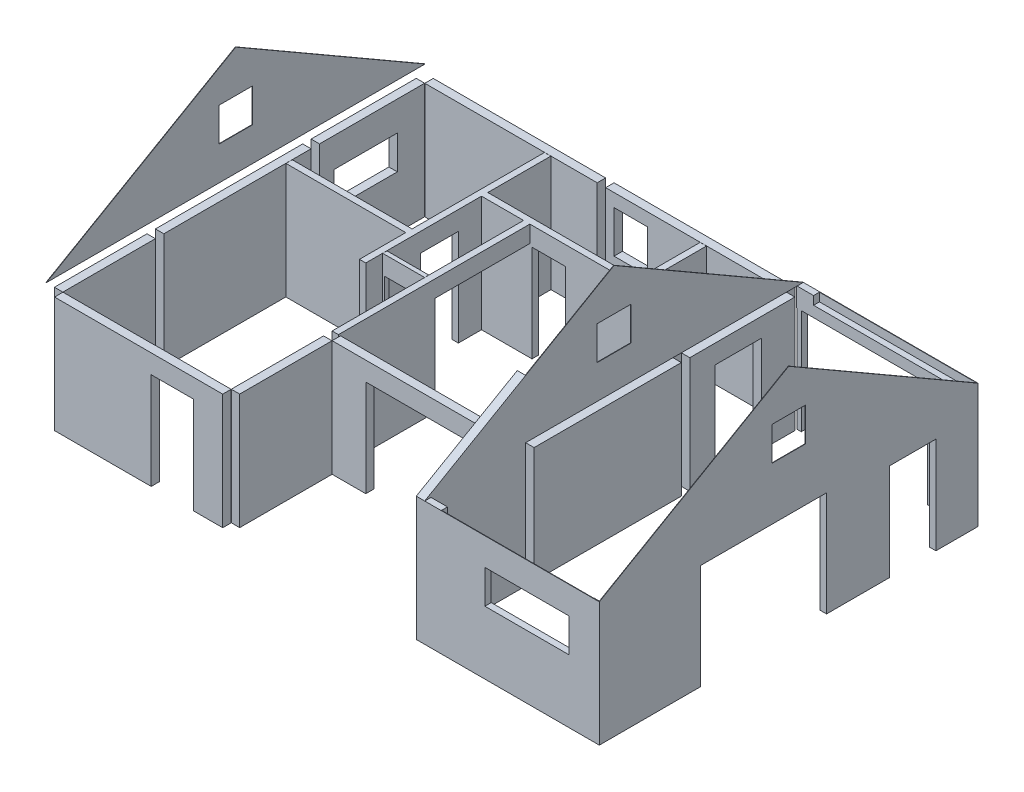
from build123d import *

# Parameters (mm, degrees)
SKETCH_1_W          = 200
SKETCH_1_H          = 797
EXTRUDE_3_DEPTH     = 2750
SKETCH_1_W_2        = 4097
SKETCH_1_H_2        = 200
EXTRUDE_3_2_DEPTH   = 2750
SKETCH_1_H_3        = 2500
EXTRUDE_3_3_DEPTH   = 2750
SKETCH_1_W_3        = 2297
EXTRUDE_3_4_DEPTH   = 2750
SKETCH_1_H_4        = 2194
EXTRUDE_3_5_DEPTH   = 2750
SKETCH_1_W_4        = 1200
EXTRUDE_3_6_DEPTH   = 2750
SKETCH_1_W_5        = 700
EXTRUDE_3_7_DEPTH   = 2750
SKETCH_1_W_6        = 1197
EXTRUDE_3_8_DEPTH   = 2750
SKETCH_1_H_5        = 600
EXTRUDE_3_9_DEPTH   = 2750
SKETCH_1_W_7        = 150
SKETCH_1_H_6        = 2300
EXTRUDE_3_10_DEPTH  = 2750
SKETCH_1_H_7        = 2200
EXTRUDE_3_11_DEPTH  = 2750
SKETCH_1_H_8        = 3500
EXTRUDE_3_12_DEPTH  = 2750
EXTRUDE_3_13_DEPTH  = 2750
SKETCH_1_W_8        = 4300
EXTRUDE_3_14_DEPTH  = 2750
EXTRUDE_3_15_DEPTH  = 2750
EXTRUDE_3_16_DEPTH  = 2750
SKETCH_1_W_9        = 47
SKETCH_1_H_9        = 100
EXTRUDE_3_17_DEPTH  = 2750
EXTRUDE_3_18_DEPTH  = 2750
EXTRUDE_3_19_DEPTH  = 2750
SKETCH_2_W          = 1500
SKETCH_2_H          = 800
CUT_EXTRUDE_2_DEPTH = 250
SKETCH_3_W          = 800
SKETCH_3_H          = 1000
CUT_EXTRUDE_3_DEPTH = 593
SKETCH_4_W          = 947
SKETCH_4_H          = 100
SKETCH_4_W_2        = 150
SKETCH_4_H_2        = 978.549648511
SKETCH_4_W_3        = 1152.585456484
SKETCH_4_H_3        = 150
SKETCH_4_W_4        = 2267.433140047
SKETCH_4_H_4        = 200
SKETCH_4_W_5        = 200
SKETCH_4_H_5        = 1253.150135291
SKETCH_4_W_6        = 1218.539312582
SKETCH_4_H_6        = 203
EXTRUDE_4_DEPTH     = 450
EXTRUDE_5_DEPTH     = 150
SKETCH_6_W          = 1100
SKETCH_6_H          = 2300
SKETCH_6_W_2        = 3000
SKETCH_6_H_2        = 2644.337567297
CUT_EXTRUDE_5_DEPTH = 670
SKETCH_8_W          = 800
SKETCH_8_H          = 800
EXTRUDE_8_DEPTH     = 10
EXTRUDE_9_DEPTH     = 200
SKETCH_10_W         = 4000
SKETCH_10_H         = 150
SKETCH_10_W_2       = 900
SKETCH_10_W_3       = 100
EXTRUDE_10_DEPTH    = 2950
SKETCH_11_W         = 2397
SKETCH_11_H         = 2635.525513421
SKETCH_11_W_2       = 1000
SKETCH_11_H_2       = 2423.148146905
SKETCH_11_W_3       = 2000
SKETCH_11_H_3       = 800
CUT_EXTRUDE_6_DEPTH = 5123
SKETCH_8_2_W        = 800
SKETCH_8_2_H        = 800
CUT_EXTRUDE_7_DEPTH = 16606
SKETCH_16_W         = 150
SKETCH_16_H         = 455.662432703
EXTRUDE_16_DEPTH    = 4160
SKETCH_17_W         = 150
SKETCH_17_H         = 400
EXTRUDE_17_DEPTH    = 2250
SKETCH_18_W         = 345.470179312
SKETCH_18_H         = 6646.060485842
SKETCH_18_W_2       = 3747.534838004
SKETCH_18_H_2       = 8980
CUT_EXTRUDE_8_DEPTH = 5414


with BuildPart() as part:
    # Эскиз1 → Бобышка-Вытянуть3 (new body)
    with BuildSketch(Plane(origin=(0, 0, 0), x_dir=(1, 0, 0), z_dir=(0, 1, 0))):
        with Locations((8900, -601.5)):
            Rectangle(SKETCH_1_W, SKETCH_1_H)
    extrude(amount=EXTRUDE_3_DEPTH)



with BuildPart() as body_2:
    # Эскиз1 → Extrude 3 2 (new body)
    with BuildSketch(Plane(origin=(0, 0, 0), x_dir=(1, 0, 0), z_dir=(0, 1, 0))):
        with Locations((2251.5, -100)):
            Rectangle(SKETCH_1_W_2, SKETCH_1_H_2)
    extrude(amount=EXTRUDE_3_2_DEPTH)


with BuildPart() as body_3:
    # Эскиз1 → Extrude 3 3 (new body)
    with BuildSketch(Plane(origin=(0, 0, 0), x_dir=(1, 0, 0), z_dir=(0, 1, 0))):
        with Locations((100, -1450)):
            Rectangle(SKETCH_1_W, SKETCH_1_H_3)
    extrude(amount=EXTRUDE_3_3_DEPTH)

    # Эскиз2 → Вырез-Вытянуть2 (cut)
    with BuildSketch(Plane.ZY):
        with Locations((1600, 1650)):
            Rectangle(SKETCH_2_W, SKETCH_2_H)
    extrude(amount=-CUT_EXTRUDE_2_DEPTH, mode=Mode.SUBTRACT)


with BuildPart() as body_4:
    # Эскиз1 → Extrude 3 4 (new body)
    with BuildSketch(Plane(origin=(0, 0, 0), x_dir=(1, 0, 0), z_dir=(0, 1, 0))):
        with Locations((1351.5, -8900)):
            Rectangle(SKETCH_1_W_3, SKETCH_1_H_2)
    extrude(amount=EXTRUDE_3_4_DEPTH)


with BuildPart() as body_5:
    # Эскиз1 → Extrude 3 5 (new body)
    with BuildSketch(Plane(origin=(0, 0, 0), x_dir=(1, 0, 0), z_dir=(0, 1, 0))):
        with Locations((4300, -7700)):
            Rectangle(SKETCH_1_W, SKETCH_1_H_4)
    extrude(amount=EXTRUDE_3_5_DEPTH)


with BuildPart() as body_6:
    # Эскиз1 → Extrude 3 6 (new body)
    with BuildSketch(Plane(origin=(0, 0, 0), x_dir=(1, 0, 0), z_dir=(0, 1, 0))):
        with Locations((8197, -6500)):
            Rectangle(SKETCH_1_W_4, SKETCH_1_H_2)
    extrude(amount=EXTRUDE_3_6_DEPTH)


with BuildPart() as body_7:
    # Эскиз1 → Extrude 3 7 (new body)
    with BuildSketch(Plane(origin=(0, 0, 0), x_dir=(1, 0, 0), z_dir=(0, 1, 0))):
        with Locations((3850, -8900)):
            Rectangle(SKETCH_1_W_5, SKETCH_1_H_2)
    extrude(amount=EXTRUDE_3_7_DEPTH)


with BuildPart() as body_8:
    # Эскиз1 → Extrude 3 8 (new body)
    with BuildSketch(Plane(origin=(0, 0, 0), x_dir=(1, 0, 0), z_dir=(0, 1, 0))):
        with Locations((4998.5, -6500)):
            Rectangle(SKETCH_1_W_6, SKETCH_1_H_2)
    extrude(amount=EXTRUDE_3_8_DEPTH)


with BuildPart() as body_9:
    # Эскиз1 → Extrude 3 9 (new body)
    with BuildSketch(Plane(origin=(0, 0, 0), x_dir=(1, 0, 0), z_dir=(0, 1, 0))):
        with Locations((8900, -2400)):
            Rectangle(SKETCH_1_W, SKETCH_1_H_5)
    extrude(amount=EXTRUDE_3_9_DEPTH)


with BuildPart() as body_10:
    # Эскиз1 → Extrude 3 10 (new body)
    with BuildSketch(Plane(origin=(0, 0, 0), x_dir=(1, 0, 0), z_dir=(0, 1, 0))):
        with Locations((4275, -5250)):
            Rectangle(SKETCH_1_W_7, SKETCH_1_H_6)
    extrude(amount=EXTRUDE_3_10_DEPTH)


with BuildPart() as body_11:
    # Эскиз1 → Extrude 3 11 (new body)
    with BuildSketch(Plane(origin=(0, 0, 0), x_dir=(1, 0, 0), z_dir=(0, 1, 0))):
        with Locations((100, -7700)):
            Rectangle(SKETCH_1_W, SKETCH_1_H_7)
    extrude(amount=EXTRUDE_3_11_DEPTH)


with BuildPart() as body_12:
    # Эскиз1 → Extrude 3 12 (new body)
    with BuildSketch(Plane(origin=(0, 0, 0), x_dir=(1, 0, 0), z_dir=(0, 1, 0))):
        with Locations((8900, -4650)):
            Rectangle(SKETCH_1_W, SKETCH_1_H_8)
    extrude(amount=EXTRUDE_3_12_DEPTH)


with BuildPart() as body_13:
    # Эскиз1 → Extrude 3 13 (new body)
    with BuildSketch(Plane(origin=(0, 0, 0), x_dir=(1, 0, 0), z_dir=(0, 1, 0))):
        with Locations((100, -4650)):
            Rectangle(SKETCH_1_W, SKETCH_1_H_8)
    extrude(amount=EXTRUDE_3_13_DEPTH)


with BuildPart() as body_14:
    # Эскиз1 → Extrude 3 14 (new body)
    with BuildSketch(Plane(origin=(0, 0, 0), x_dir=(1, 0, 0), z_dir=(0, 1, 0))):
        with Locations((6650, -100)):
            Rectangle(SKETCH_1_W_8, SKETCH_1_H_2)
    extrude(amount=EXTRUDE_3_14_DEPTH)

    # Эскиз3 → Вырез-Вытянуть3 (cut)
    with BuildSketch(Plane(origin=(0, 0, 0), x_dir=(-1, 0, 0), z_dir=(0, 0, -1))):
        with Locations((-5100, 1940)):
            Rectangle(SKETCH_3_W, SKETCH_3_H)
    extrude(amount=-CUT_EXTRUDE_3_DEPTH, mode=Mode.SUBTRACT)


with BuildPart() as body_15:
    # Эскиз1 → Extrude 3 15 (new body)
    with BuildSketch(Plane(origin=(0, 0, 0), x_dir=(1, 0, 0), z_dir=(0, 1, 0))):
        Polygon((3200, -203), (3050, -203), (3050, -2400), (3200, -2400), (3200, -1850), (4400, -1850), (4400, -1700), (3200, -1700), align=None)
    extrude(amount=EXTRUDE_3_15_DEPTH)


with BuildPart() as body_16:
    # Эскиз1 → Extrude 3 16 (new body)
    with BuildSketch(Plane(origin=(0, 0, 0), x_dir=(1, 0, 0), z_dir=(0, 1, 0))):
        Polygon((3200, -3300), (3050, -3300), (3050, -3350), (203, -3350), (203, -3500), (3050, -3500), (3050, -4600), (3200, -4600), align=None)
    extrude(amount=EXTRUDE_3_16_DEPTH)


with BuildPart() as body_17:
    # Эскиз1 → Extrude 3 17 (new body)
    with BuildSketch(Plane(origin=(0, 0, 0), x_dir=(1, 0, 0), z_dir=(0, 1, 0))):
        with Locations((4173.5, -4150)):
            Rectangle(SKETCH_1_W_9, SKETCH_1_H_9)
    extrude(amount=EXTRUDE_3_17_DEPTH)


with BuildPart() as body_18:
    # Эскиз1 → Extrude 3 18 (new body)
    with BuildSketch(Plane(origin=(0, 0, 0), x_dir=(1, 0, 0), z_dir=(0, 1, 0))):
        Polygon((6750, -1700), (5200, -1700), (5200, -1850), (6900, -1850), (6900, -203), (6750, -203), align=None)
    extrude(amount=EXTRUDE_3_18_DEPTH)


with BuildPart() as body_19:
    # Эскиз1 → Extrude 3 19 (new body)
    with BuildSketch(Plane(origin=(0, 0, 0), x_dir=(1, 0, 0), z_dir=(0, 1, 0))):
        with Locations((3226.5, -4150)):
            Rectangle(SKETCH_1_W_9, SKETCH_1_H_9)
    extrude(amount=EXTRUDE_3_19_DEPTH)


with BuildPart() as part_1:
    add(part.part)

    add(body_4.part)  # Бобышка-Вытянуть4 merges body 4

    add(body_6.part)  # Бобышка-Вытянуть4 merges body 6

    add(body_7.part)  # Бобышка-Вытянуть4 merges body 7

    add(body_8.part)  # Бобышка-Вытянуть4 merges body 8

    add(body_9.part)  # Бобышка-Вытянуть4 merges body 9

    add(body_15.part)  # Бобышка-Вытянуть4 merges body 15

    add(body_16.part)  # Бобышка-Вытянуть4 merges body 16

    add(body_17.part)  # Бобышка-Вытянуть4 merges body 17

    add(body_18.part)  # Бобышка-Вытянуть4 merges body 18

    add(body_19.part)  # Бобышка-Вытянуть4 merges body 19
    # Эскиз4 → Бобышка-Вытянуть4 (add)
    with BuildSketch(Plane(origin=(0, 2750, 0), x_dir=(1, 0, 0), z_dir=(0, 1, 0))):
        with Locations((3700, -4150)):
            Rectangle(SKETCH_4_W, SKETCH_4_H)
        with Locations((3125, -2835.725175745)):
            Rectangle(SKETCH_4_W_2, SKETCH_4_H_2)
        with Locations((4825.793421021, -1775)):
            Rectangle(SKETCH_4_W_3, SKETCH_4_H_3)
        with Locations((6556.719626978, -6500)):
            Rectangle(SKETCH_4_W_4, SKETCH_4_H_4)
        with Locations((8900, -1527.400889881)):
            Rectangle(SKETCH_4_W_5, SKETCH_4_H_5)
        with Locations((2988.285525283, -8898.5)):
            Rectangle(SKETCH_4_W_6, SKETCH_4_H_6)
    extrude(amount=-EXTRUDE_4_DEPTH)


with BuildPart() as body_10_2:
    # Эскиз5 → Бобышка-Вытянуть5 (new body)
    with BuildSketch(Plane(origin=(13000, 0, 0), x_dir=(0, 0, -1), z_dir=(1, 0, 0))):
        Polygon((-4500, 5548.076211353), (-9000, 2950), (-9000, 0), (0, 0), (0, 2950), align=None)
    extrude(amount=EXTRUDE_5_DEPTH)

    # Эскиз6 → Вырез-Вытянуть5 (cut)
    with BuildSketch(Plane(origin=(13000, 0, 0), x_dir=(0, 0, -1), z_dir=(1, 0, 0))):
        with Locations((-1550, 1150)):
            Rectangle(SKETCH_6_W, SKETCH_6_H)
        with Locations((-5100, 1172.168783649)):
            Rectangle(SKETCH_6_W_2, SKETCH_6_H_2)
    extrude(amount=CUT_EXTRUDE_5_DEPTH, mode=Mode.SUBTRACT)



with BuildPart() as body_11_2:
    # Эскиз8 → Бобышка-Вытянуть8 (new body)
    with BuildSketch(Plane.ZY):
        Polygon((4500, 5548.076211353), (0, 2950), (9000, 2950), align=None)
        with Locations((4500, 4150)):
            Rectangle(SKETCH_8_W, SKETCH_8_H, mode=Mode.SUBTRACT)
    extrude(amount=-EXTRUDE_8_DEPTH)


with BuildPart() as body_12_2:
    # Эскиз9 → Бобышка-Вытянуть9 (new body)
    with BuildSketch(Plane(origin=(9000, 0, 0), x_dir=(0, 0, -1), z_dir=(1, 0, 0))):
        Polygon((-6600, 0), (-6600, 2950), (0, 2950), (-4500, 5548.076211353), (-9000, 2950), (-9000, 0), align=None)
    extrude(amount=-EXTRUDE_9_DEPTH)


with BuildPart() as body_10_2_1:
    add(body_10_2.part)

    add(body_12_2.part)  # Бобышка-Вытянуть10 merges body 12 2
    # Эскиз10 → Бобышка-Вытянуть10 (add)
    with BuildSketch(Plane.XZ):
        with Locations((11000, 8925)):
            Rectangle(SKETCH_10_W, SKETCH_10_H)
        with Locations((12550, 75)):
            Rectangle(SKETCH_10_W_2, SKETCH_10_H)
        with Locations((9050, 75)):
            Rectangle(SKETCH_10_W_3, SKETCH_10_H)
    extrude(amount=-EXTRUDE_10_DEPTH)


with BuildPart() as cut_extrude_6_tool:
    # Эскиз11 → Вырез-Вытянуть6 (new body)
    with BuildSketch(Plane(origin=(0, 0, 6400), x_dir=(-1, 0, 0), z_dir=(0, 0, -1))):
        with Locations((-6398.5, 982.237243289)):
            Rectangle(SKETCH_11_W, SKETCH_11_H)
        with Locations((-3000, 1088.425926548)):
            Rectangle(SKETCH_11_W_2, SKETCH_11_H_2)
        with Locations((-11431.097201215, 1900)):
            Rectangle(SKETCH_11_W_3, SKETCH_11_H_3)
    extrude(amount=-CUT_EXTRUDE_6_DEPTH)


with BuildPart() as part_2:
    add(part_1.part)

    # Вырез-Вытянуть6: cut by cut_extrude_6_tool
    add(cut_extrude_6_tool.part, mode=Mode.SUBTRACT)


    add(body_10.part)  # Бобышка-Вытянуть17 merges body 10
    # Эскиз17 → Бобышка-Вытянуть17 (add)
    with BuildSketch(Plane(origin=(0, 0, 4100), x_dir=(-1, 0, 0), z_dir=(0, 0, -1))):
        with Locations((-4275, 2550)):
            Rectangle(SKETCH_17_W, SKETCH_17_H)
    extrude(amount=EXTRUDE_17_DEPTH)


with BuildPart() as body_10_2_2:
    add(body_10_2_1.part)

    # Вырез-Вытянуть6: cut by cut_extrude_6_tool
    add(cut_extrude_6_tool.part, mode=Mode.SUBTRACT)

    # Эскиз8<2> → Вырез-Вытянуть7 (cut)
    with BuildSketch(Plane.ZY):
        with Locations((4500, 4150)):
            Rectangle(SKETCH_8_2_W, SKETCH_8_2_H)
    extrude(amount=-CUT_EXTRUDE_7_DEPTH, mode=Mode.SUBTRACT)

    # Эскиз16 → Бобышка-Вытянуть16 (add)
    with BuildSketch(Plane(origin=(13150, 0, 0), x_dir=(0, 0, -1), z_dir=(1, 0, 0))):
        with Locations((-75, 2722.168783648)):
            Rectangle(SKETCH_16_W, SKETCH_16_H)
    extrude(amount=-EXTRUDE_16_DEPTH)

    # Эскиз18 → Вырез-Вытянуть8 (cut)
    with BuildSketch(Plane(origin=(0, 2750, 0), x_dir=(1, 0, 0), z_dir=(0, 1, 0))):
        with Locations((8817.264910344, -3276.969757079)):
            Rectangle(SKETCH_18_W, SKETCH_18_H)
        with Locations((11266.232580998, -4500)):
            Rectangle(SKETCH_18_W_2, SKETCH_18_H_2)
    extrude(amount=CUT_EXTRUDE_8_DEPTH, mode=Mode.SUBTRACT)


solid = Compound([body_2.part, body_3.part, body_5.part, body_11.part, body_12.part, body_13.part, body_14.part, body_11_2.part, part_2.part, body_10_2_2.part])
